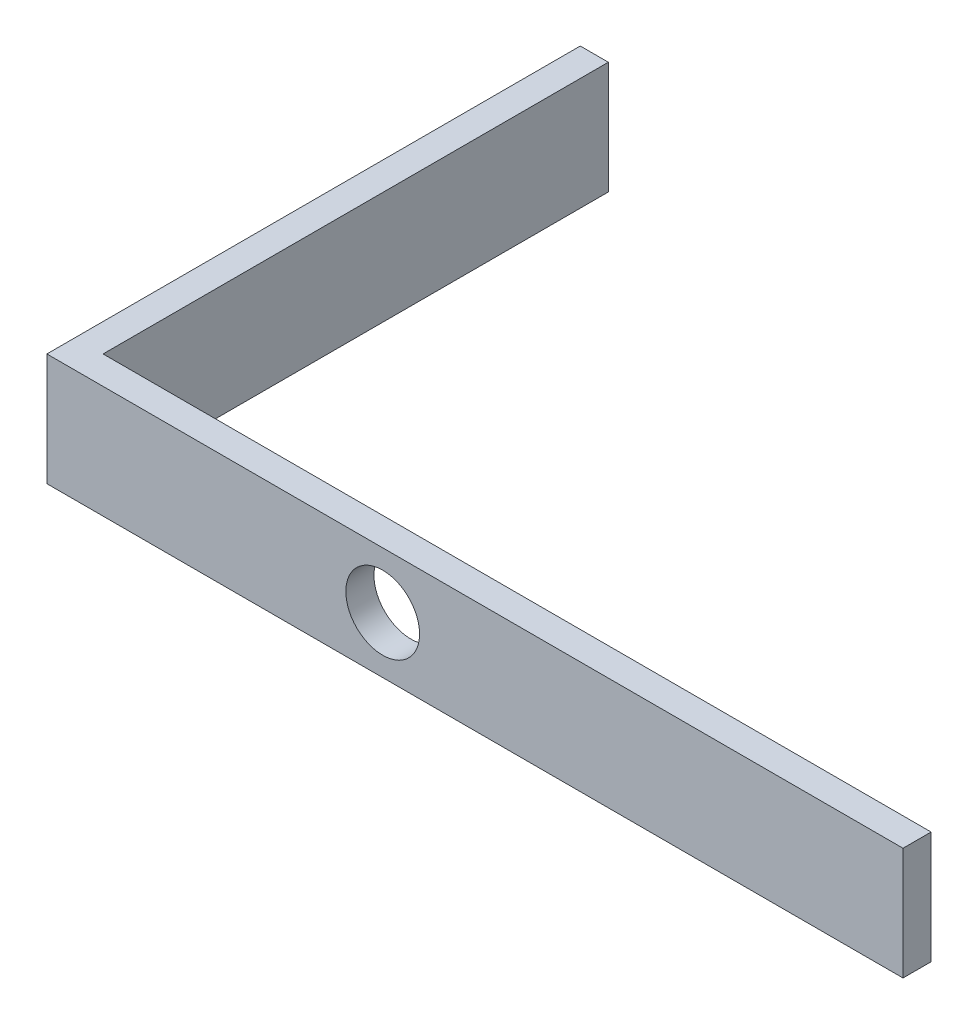
from build123d import *

# Parameters (mm, degrees)
BOSS_EXTRUDE1_DEPTH = 7.9375
SKETCH2_R           = 5.207
CUT_EXTRUDE1_DEPTH  = 3.96875


with BuildPart() as part:
    # Sketch1 → Boss-Extrude1 (new, symmetric)
    with BuildSketch(Plane(origin=(0, 0, 0), x_dir=(1, 0, 0), z_dir=(0, 1, 0))):
        Polygon((0, 0), (3.96875, 0), (120.93575, 0), (120.93575, 3.96875), (3.96875, 3.96875), (3.96875, 75.34275), (0, 75.34275), align=None)
    extrude(amount=BOSS_EXTRUDE1_DEPTH, both=True)

    # Sketch2 → Cut-Extrude1 (cut)
    with BuildSketch(Plane.XY):
        with Locations((47.4345, 0)):
            Circle(SKETCH2_R)
    extrude(amount=-CUT_EXTRUDE1_DEPTH, mode=Mode.SUBTRACT)


solid = part.part
